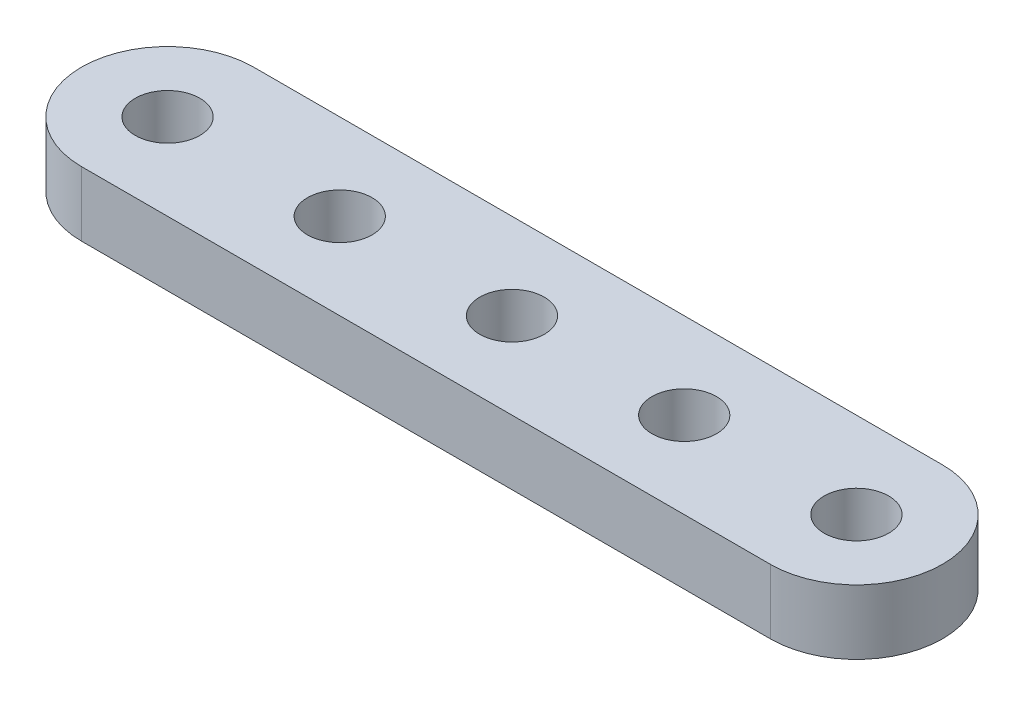
from build123d import *

# Parameters (mm, degrees)
SKETCH2_R             = 1.5
BOSS_EXTRUDE2_DEPTH   = 3
BOSS_EXTRUDE2_2_DEPTH = 3
BOSS_EXTRUDE2_3_DEPTH = 3
BOSS_EXTRUDE2_4_DEPTH = 3
BOSS_EXTRUDE2_5_DEPTH = 3
BOSS_EXTRUDE2_6_DEPTH = 3
BOSS_EXTRUDE2_7_DEPTH = 3
SKETCH3_W             = 48.454319831
SKETCH3_H             = 7.747522056
CUT_EXTRUDE1_DEPTH    = 10


with BuildPart() as part:
    # Sketch2 → Boss-Extrude2 (new body)
    with BuildSketch(Plane(origin=(0, 0, 0), x_dir=(1, 0, 0), z_dir=(0, 1, 0))):
        with Locations(Location((40, 0, 0), (0, 0, 270))):
            Circle(SKETCH2_R)
    extrude(amount=BOSS_EXTRUDE2_DEPTH)


with BuildPart() as body_2:
    # Sketch2 → Boss-Extrude2 2 (new body)
    with BuildSketch(Plane(origin=(0, 0, 0), x_dir=(1, 0, 0), z_dir=(0, 1, 0))):
        with Locations(Location((48, 0, 0), (0, 0, 270))):
            Circle(SKETCH2_R)
    extrude(amount=BOSS_EXTRUDE2_2_DEPTH)


with BuildPart() as body_3:
    # Sketch2 → Boss-Extrude2 3 (new body)
    with BuildSketch(Plane(origin=(0, 0, 0), x_dir=(1, 0, 0), z_dir=(0, 1, 0))):
        with Locations(Location((56, 0, 0), (0, 0, 270))):
            Circle(SKETCH2_R)
    extrude(amount=BOSS_EXTRUDE2_3_DEPTH)


with BuildPart() as body_4:
    # Sketch2 → Boss-Extrude2 4 (new body)
    with BuildSketch(Plane(origin=(0, 0, 0), x_dir=(1, 0, 0), z_dir=(0, 1, 0))):
        with Locations(Location((64, 0, 0), (0, 0, 270))):
            Circle(SKETCH2_R)
    extrude(amount=BOSS_EXTRUDE2_4_DEPTH)


with BuildPart() as body_5:
    # Sketch2 → Boss-Extrude2 5 (new body)
    with BuildSketch(Plane(origin=(0, 0, 0), x_dir=(1, 0, 0), z_dir=(0, 1, 0))):
        with Locations(Location((72, 0, 0), (0, 0, 270))):
            Circle(SKETCH2_R)
    extrude(amount=BOSS_EXTRUDE2_5_DEPTH)


with BuildPart() as body_6:
    # Sketch2 → Boss-Extrude2 6 (new body)
    with BuildSketch(Plane(origin=(0, 0, 0), x_dir=(1, 0, 0), z_dir=(0, 1, 0))):
        with Locations(Location((80, 0, 0), (0, 0, 270))):
            Circle(SKETCH2_R)
    extrude(amount=BOSS_EXTRUDE2_6_DEPTH)


with BuildPart() as body_7:
    # Sketch2 → Boss-Extrude2 7 (new body)
    with BuildSketch(Plane(origin=(0, 0, 0), x_dir=(1, 0, 0), z_dir=(0, 1, 0))):
        with BuildLine():
            Line((0, 4), (32, 4))
            ThreePointArc((32, 4), (36, 0), (32, -4))
            Line((32, -4), (0, -4))
            ThreePointArc((0, -4), (-4, 0), (0, 4))
        make_face()
        with Locations(Location((0, 0, 0), (0, 0, 270))):
            Circle(SKETCH2_R, mode=Mode.SUBTRACT)
        with Locations(Location((8, 0, 0), (0, 0, 270))):
            Circle(SKETCH2_R, mode=Mode.SUBTRACT)
        with Locations(Location((16, 0, 0), (0, 0, 270))):
            Circle(SKETCH2_R, mode=Mode.SUBTRACT)
        with Locations(Location((24, 0, 0), (0, 0, 270))):
            Circle(SKETCH2_R, mode=Mode.SUBTRACT)
        with Locations(Location((32, 0, 0), (0, 0, 270))):
            Circle(SKETCH2_R, mode=Mode.SUBTRACT)
    extrude(amount=BOSS_EXTRUDE2_7_DEPTH)


with BuildPart() as cut_extrude1_tool:
    # Sketch3 → Cut-Extrude1 (new body)
    with BuildSketch(Plane(origin=(0, 0, 0), x_dir=(-1, 0, 0), z_dir=(0, -1, 0))):
        with Locations((-61.501049379, -0.745868802)):
            Rectangle(SKETCH3_W, SKETCH3_H)
    extrude(amount=-CUT_EXTRUDE1_DEPTH)


with BuildPart() as part_1:
    add(part.part)

    # Cut-Extrude1: cut by cut_extrude1_tool
    add(cut_extrude1_tool.part, mode=Mode.SUBTRACT)


with BuildPart() as body_2_1:
    add(body_2.part)

    # Cut-Extrude1: cut by cut_extrude1_tool
    add(cut_extrude1_tool.part, mode=Mode.SUBTRACT)


with BuildPart() as body_3_1:
    add(body_3.part)

    # Cut-Extrude1: cut by cut_extrude1_tool
    add(cut_extrude1_tool.part, mode=Mode.SUBTRACT)


with BuildPart() as body_4_1:
    add(body_4.part)

    # Cut-Extrude1: cut by cut_extrude1_tool
    add(cut_extrude1_tool.part, mode=Mode.SUBTRACT)


with BuildPart() as body_5_1:
    add(body_5.part)

    # Cut-Extrude1: cut by cut_extrude1_tool
    add(cut_extrude1_tool.part, mode=Mode.SUBTRACT)


with BuildPart() as body_6_1:
    add(body_6.part)

    # Cut-Extrude1: cut by cut_extrude1_tool
    add(cut_extrude1_tool.part, mode=Mode.SUBTRACT)


solid = body_7.part
